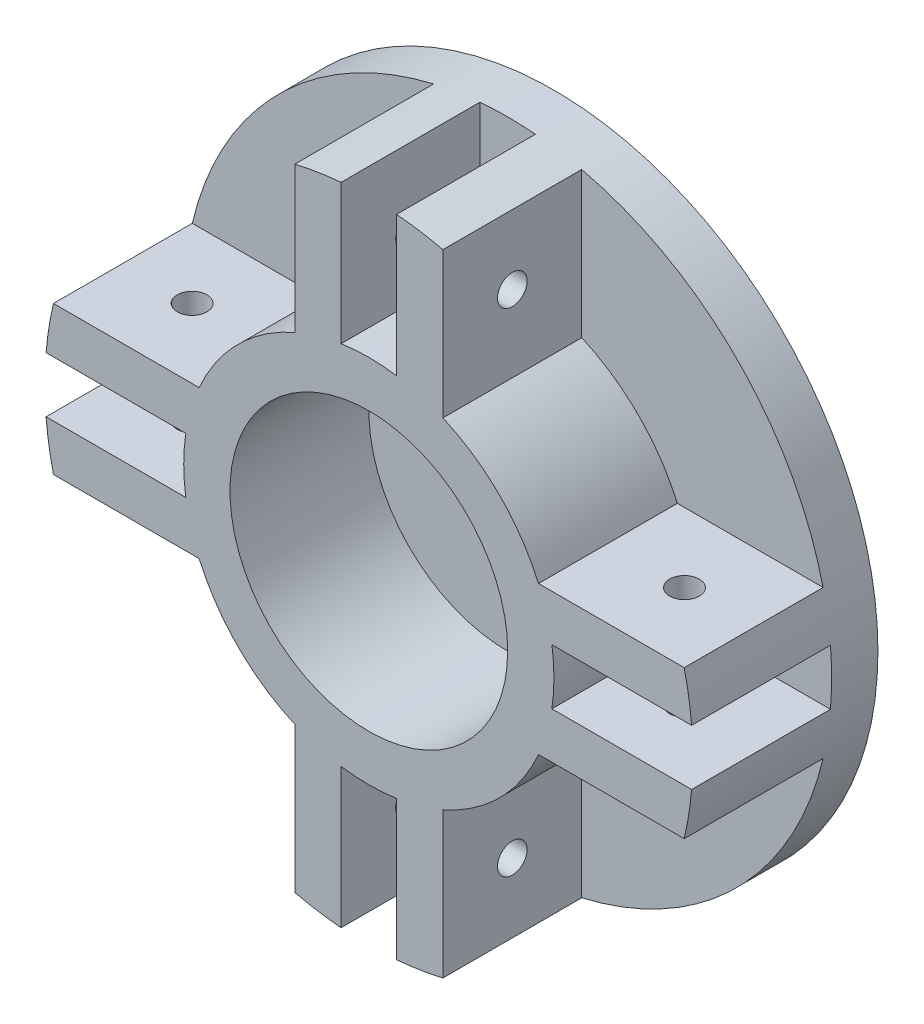
from build123d import *

# Parameters (mm, degrees)
SKETCH2_R           = 35
SKETCH2_R_2         = 5
BOSS_EXTRUDE1_DEPTH = 5
SKETCH3_R           = 20
SKETCH3_R_2         = 15
BOSS_EXTRUDE3_DEPTH = 15
SKETCH4_R           = 1.6
CUT_EXTRUDE1_DEPTH  = 59.940648113
CIRPATTERN1_COUNT   = 4


with BuildPart() as part:
    # Sketch2 → Boss-Extrude1 (new body)
    with BuildSketch(Plane.XY):
        Circle(SKETCH2_R)
        Circle(SKETCH2_R_2, mode=Mode.SUBTRACT)
    extrude(amount=BOSS_EXTRUDE1_DEPTH)

    # Sketch3 → Boss-Extrude3 (add)
    # profile 1 of 9: a face of its own
    with BuildSketch(Plane.XY.offset(5)):
        with BuildLine():
            ThreePointArc((-3, -19.773719933), (-5.547149112, -19.215335978), (-8, -18.33030278))
            Line((-8, -18.33030278), (-8, -34.073450075))
            ThreePointArc((-8, -34.073450075), (-5.514444475, -34.562854369), (-3, -34.871191548))
            Line((-3, -34.871191548), (-3, -19.773719933))
        make_face()
    # profile 2 of 9: a face of its own
    with BuildSketch(Plane.XY.offset(5)):
        with BuildLine():
            Line((8, -34.073450075), (8, -18.33030278))
            ThreePointArc((8, -18.33030278), (5.547149112, -19.215335978), (3, -19.773719933))
            Line((3, -19.773719933), (3, -34.871191548))
            ThreePointArc((3, -34.871191548), (5.514444475, -34.562854369), (8, -34.073450075))
        make_face()
    # profile 3 of 9: a face of its own
    with BuildSketch(Plane.XY.offset(5)):
        with BuildLine():
            Line((34.871191548, -3), (19.773719933, -3))
            ThreePointArc((19.773719933, -3), (19.215335978, -5.547149112), (18.33030278, -8))
            Line((18.33030278, -8), (34.073450075, -8))
            ThreePointArc((34.073450075, -8), (34.562854369, -5.514444475), (34.871191548, -3))
        make_face()
    # profile 4 of 9: a face of its own
    with BuildSketch(Plane.XY.offset(5)):
        with BuildLine():
            Line((34.073450075, 8), (18.33030278, 8))
            ThreePointArc((18.33030278, 8), (19.215335978, 5.547149112), (19.773719933, 3))
            Line((19.773719933, 3), (34.871191548, 3))
            ThreePointArc((34.871191548, 3), (34.562854369, 5.514444475), (34.073450075, 8))
        make_face()
    # profile 5 of 9: a face of its own
    with BuildSketch(Plane.XY.offset(5)):
        with BuildLine():
            Line((3, 34.871191548), (3, 19.773719933))
            ThreePointArc((3, 19.773719933), (5.547149112, 19.215335978), (8, 18.33030278))
            Line((8, 18.33030278), (8, 34.073450075))
            ThreePointArc((8, 34.073450075), (5.514444475, 34.562854369), (3, 34.871191548))
        make_face()
    # profile 6 of 9: a face of its own
    with BuildSketch(Plane.XY.offset(5)):
        with BuildLine():
            ThreePointArc((-8, 18.33030278), (-5.547149112, 19.215335978), (-3, 19.773719933))
            Line((-3, 19.773719933), (-3, 34.871191548))
            ThreePointArc((-3, 34.871191548), (-5.514444475, 34.562854369), (-8, 34.073450075))
            Line((-8, 34.073450075), (-8, 18.33030278))
        make_face()
    # profile 7 of 9: a face of its own
    with BuildSketch(Plane.XY.offset(5)):
        with BuildLine():
            ThreePointArc((-19.773719933, 3), (-19.215335978, 5.547149112), (-18.33030278, 8))
            Line((-18.33030278, 8), (-34.073450075, 8))
            ThreePointArc((-34.073450075, 8), (-34.562854369, 5.514444475), (-34.871191548, 3))
            Line((-34.871191548, 3), (-19.773719933, 3))
        make_face()
    # profile 8 of 9: a face of its own
    with BuildSketch(Plane.XY.offset(5)):
        with BuildLine():
            ThreePointArc((-18.33030278, -8), (-19.215335978, -5.547149112), (-19.773719933, -3))
            Line((-19.773719933, -3), (-34.871191548, -3))
            ThreePointArc((-34.871191548, -3), (-34.562854369, -5.514444475), (-34.073450075, -8))
            Line((-34.073450075, -8), (-18.33030278, -8))
        make_face()
    # profile 9 of 9: a face of its own
    with BuildSketch(Plane.XY.offset(5)):
        Circle(SKETCH3_R)
        Circle(SKETCH3_R_2, mode=Mode.SUBTRACT)
    extrude(amount=BOSS_EXTRUDE3_DEPTH)

    # Sketch4 → Cut-Extrude1 (cut, through all)
    with BuildSketch(Plane.ZY.offset(8)):
        with Locations((12.5, 26.596250524)):
            Circle(SKETCH4_R)
    cut_extrude1 = extrude(amount=-CUT_EXTRUDE1_DEPTH, mode=Mode.SUBTRACT)

    # CirPattern1: Cut-Extrude1 ×4 about axis
    cirpattern1_axis = Axis((0, 0, 20), (0, 0, -1))
    for i in range(1, CIRPATTERN1_COUNT):
        add(cut_extrude1.rotate(cirpattern1_axis, i * 360 / CIRPATTERN1_COUNT), mode=Mode.SUBTRACT)


solid = part.part
